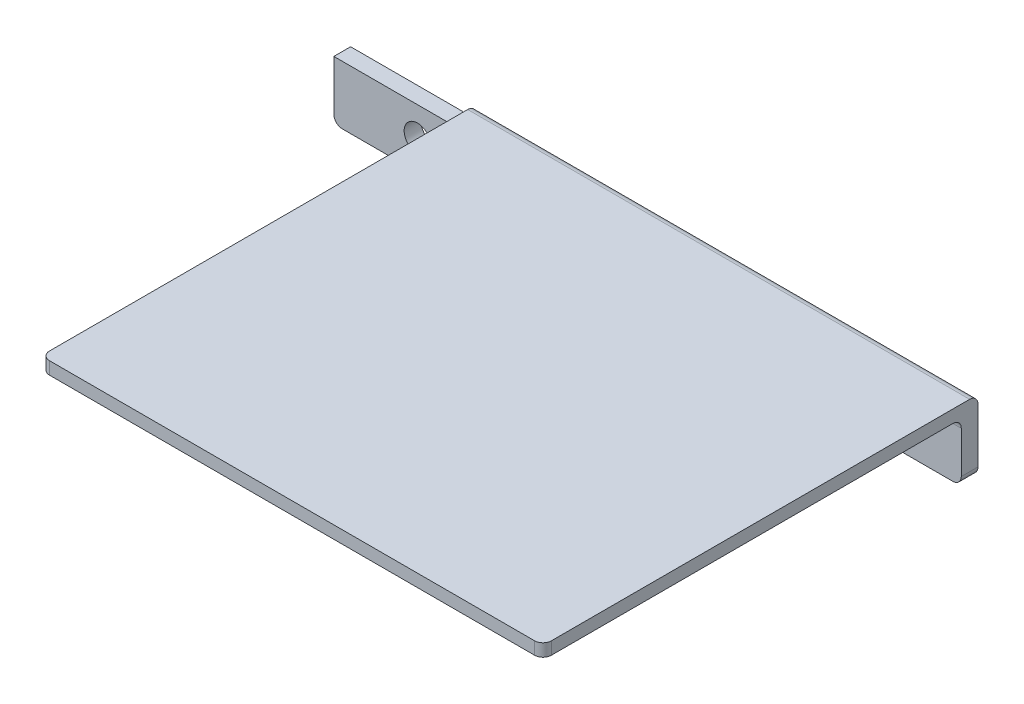
from build123d import *

# Parameters (mm, degrees)
SKETCH_1_R      = 1.6
EXTRUDE_1_DEPTH = 2
SKETCH_2_W      = 60
SKETCH_2_H      = 1.5
EXTRUDE_2_DEPTH = 50
FILLET_1_R      = 1


with BuildPart() as part:
    # 草图1 → 凸台-拉伸1 (new body)
    with BuildSketch(Plane.XY):
        Polygon((15, 0), (75, 0), (75, -8.5), (0, -8.5), (0, -1.5), (15, -1.5), align=None)
        with Locations((10, -5)):
            Circle(SKETCH_1_R, mode=Mode.SUBTRACT)
        with Locations((60, -5)):
            Circle(SKETCH_1_R, mode=Mode.SUBTRACT)
    extrude(amount=EXTRUDE_1_DEPTH)

    # 草图2 → 凸台-拉伸2 (add)
    with BuildSketch(Plane.XY.offset(2)):
        with Locations((45, -0.75)):
            Rectangle(SKETCH_2_W, SKETCH_2_H)
    extrude(amount=EXTRUDE_2_DEPTH)

    # 圆角1
    fillet_1_edges = [part.edges().sort_by_distance(p)[0] for p in [
        (75, -8.5, 1),
        (0, -8.5, 1),
        (45, -1.5, 2),
        (15, -0.75, 52),
        (75, -0.75, 52),
        (45, 0, 0),
    ]]
    fillet(fillet_1_edges, radius=FILLET_1_R)


solid = part.part
